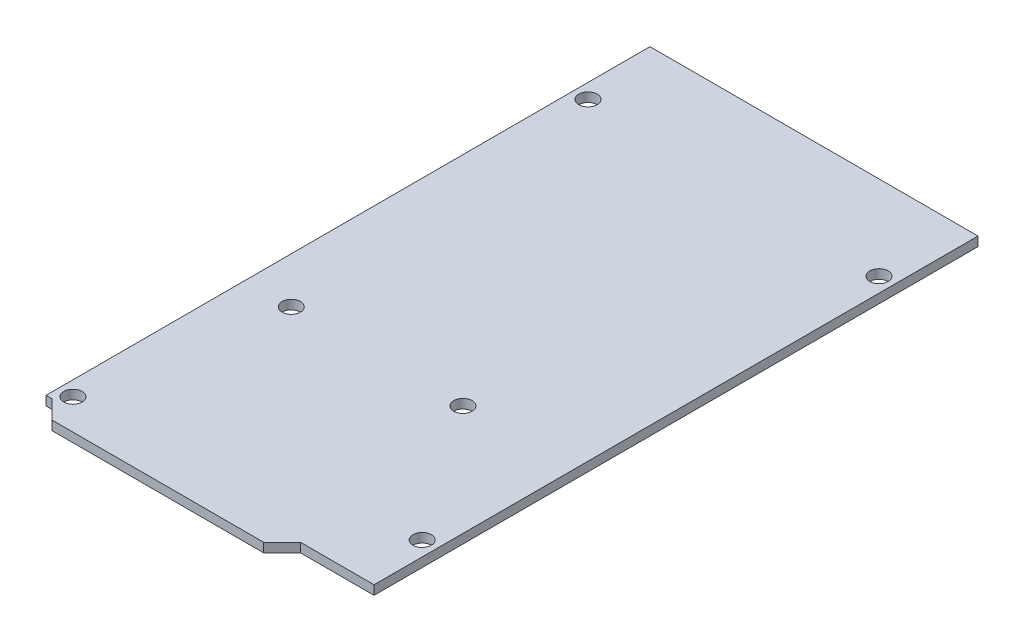
from build123d import *

# Parameters (mm, degrees)
SKETCH1_R           = 1.5
BOSS_EXTRUDE1_DEPTH = 1.5


with BuildPart() as part:
    # Sketch1 → Boss-Extrude1 (new body)
    with BuildSketch(Plane(origin=(0, 0, 0), x_dir=(1, 0, 0), z_dir=(0, 1, 0))):
        Polygon((-22.75, -50.75), (11.75, -50.75), (14.75, -47.75), (26.75, -47.75), (26.75, 50.75), (25.85, 50.75), (-20.75, 50.75), (-25.85, 50.75), (-26.75, 50.75), (-26.75, -47.75), (-25.75, -47.75), align=None)
        with Locations(Location((-24.35, -45.75, 0), (0, 0, 270))):
            Circle(SKETCH1_R, mode=Mode.SUBTRACT)
        with BuildLine():
            ThreePointArc((-17.75, -15.25), (-19.25, -16.75), (-20.75, -15.25))
            ThreePointArc((-20.75, -15.25), (-19.25, -13.75), (-17.75, -15.25))
        make_face(mode=Mode.SUBTRACT)
        with Locations(Location((24.35, -37.5, 0), (0, 0, 270))):
            Circle(SKETCH1_R, mode=Mode.SUBTRACT)
        with Locations(Location((8.75, -15.25, 0), (0, 0, 270))):
            Circle(SKETCH1_R, mode=Mode.SUBTRACT)
        with Locations(Location((-24.35, 38.25, 0), (0, 0, 270))):
            Circle(SKETCH1_R, mode=Mode.SUBTRACT)
        with BuildLine():
            ThreePointArc((24.35, 35.5), (23.289339828, 38.060660172), (25.85, 37))
            ThreePointArc((25.85, 37), (25.410660172, 35.939339828), (24.35, 35.5))
        make_face(mode=Mode.SUBTRACT)
    extrude(amount=BOSS_EXTRUDE1_DEPTH)


solid = part.part
